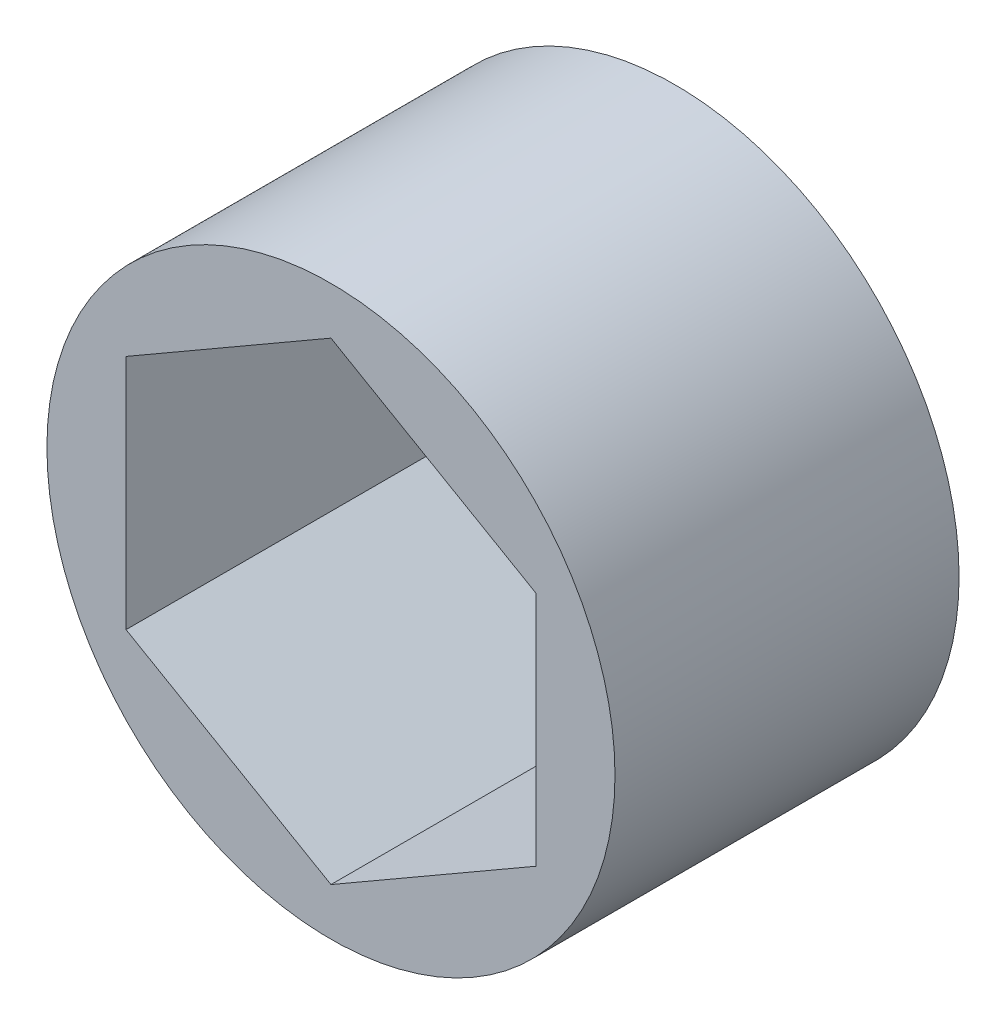
from build123d import *

# Parameters (mm, degrees)
SKETCH1_R           = 8.89
BOSS_EXTRUDE1_DEPTH = 10.7696


with BuildPart() as part:
    # Sketch1 → Boss-Extrude1 (new body)
    with BuildSketch(Plane.XY):
        Circle(SKETCH1_R)
        Polygon((0, 7.405671903), (-6.4135, 3.702835951), (-6.4135, -3.702835951), (0, -7.405671903), (6.4135, -3.702835951), (6.4135, 3.702835951), align=None, mode=Mode.SUBTRACT)
    extrude(amount=BOSS_EXTRUDE1_DEPTH)


solid = part.part
